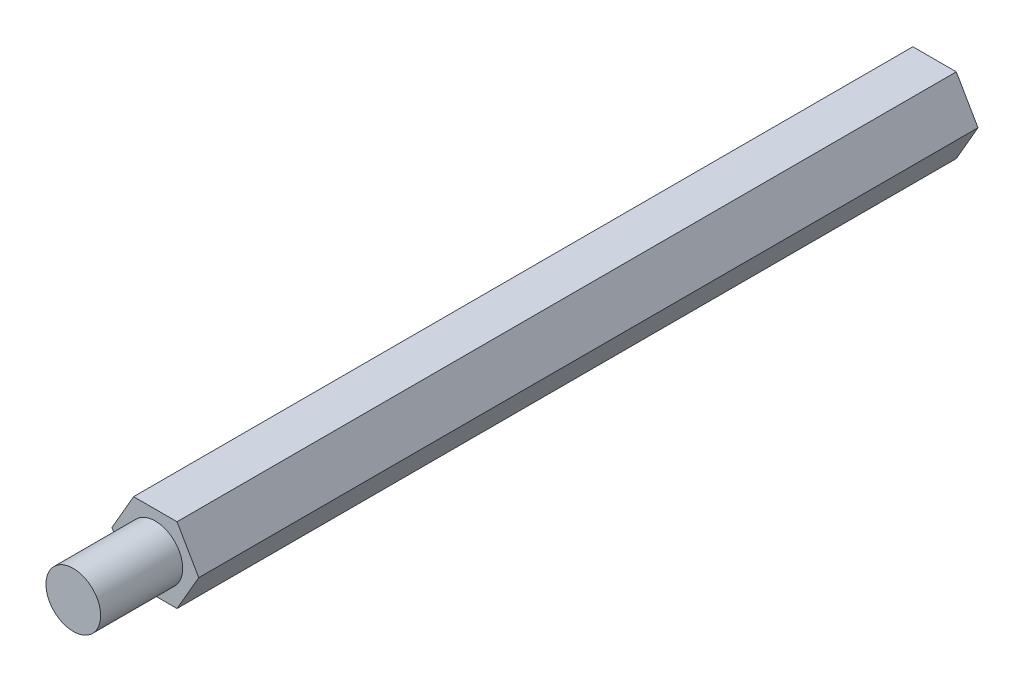
from build123d import *

# Parameters (mm, degrees)
EXTRUDE_1_DEPTH     = 57
SKETCH_2_R          = 2
EXTRUDE_2_DEPTH     = 6
SKETCH_6_R          = 1.5
CUT_EXTRUDE_1_DEPTH = 5


with BuildPart() as part:
    # 草图1 → 拉伸1 (new body)
    with BuildSketch(Plane.XY):
        Polygon((1.58771324, -2.75), (3.175426481, 0), (1.58771324, 2.75), (-1.58771324, 2.75), (-3.175426481, 0), (-1.58771324, -2.75), align=None)
    extrude(amount=EXTRUDE_1_DEPTH)

    # 草图2 → 拉伸2 (add)
    with BuildSketch(Plane.XY.offset(57)):
        Circle(SKETCH_2_R)
    extrude(amount=EXTRUDE_2_DEPTH)

    # 草图6 → 切除-拉伸1 (cut)
    with BuildSketch(Plane(origin=(0, 0, 0), x_dir=(-1, 0, 0), z_dir=(0, 0, -1))):
        Circle(SKETCH_6_R)
    extrude(amount=-CUT_EXTRUDE_1_DEPTH, mode=Mode.SUBTRACT)


solid = part.part
